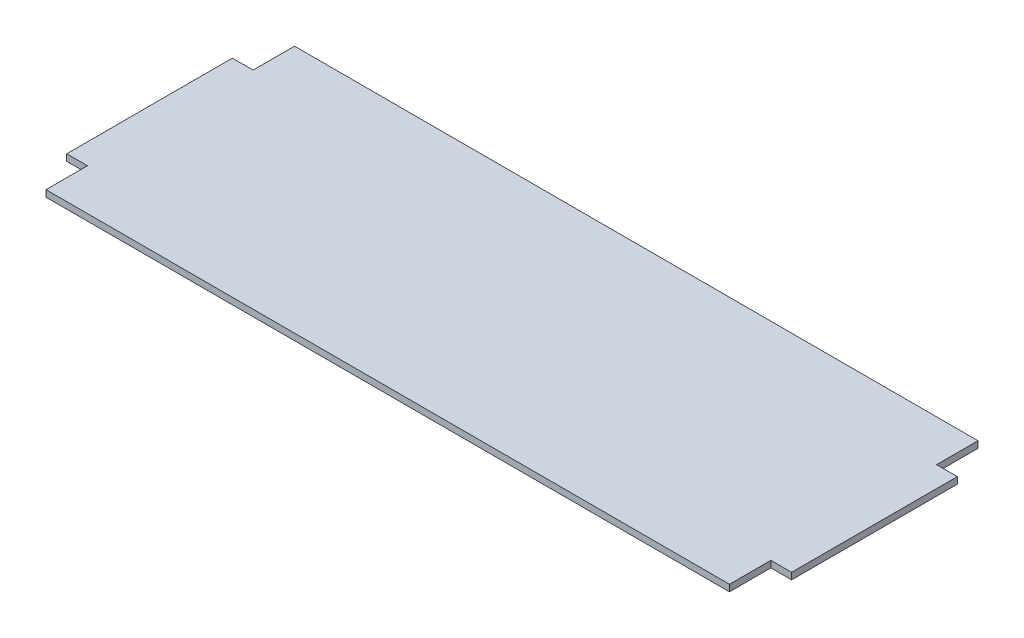
from build123d import *

# Parameters (mm, degrees)
BOSS_EXTRUDE1_DEPTH = 12.7


with BuildPart() as part:
    # Sketch1 → Boss-Extrude1 (new body)
    with BuildSketch(Plane(origin=(0, 0, 0), x_dir=(1, 0, 0), z_dir=(0, 1, 0))):
        Polygon((40, 0), (1360, 0), (1360, 80), (1400, 80), (1400, 400), (1360, 400), (1360, 480), (40, 480), (40, 400), (0, 400), (0, 80), (40, 80), align=None)
    extrude(amount=BOSS_EXTRUDE1_DEPTH)


solid = part.part
